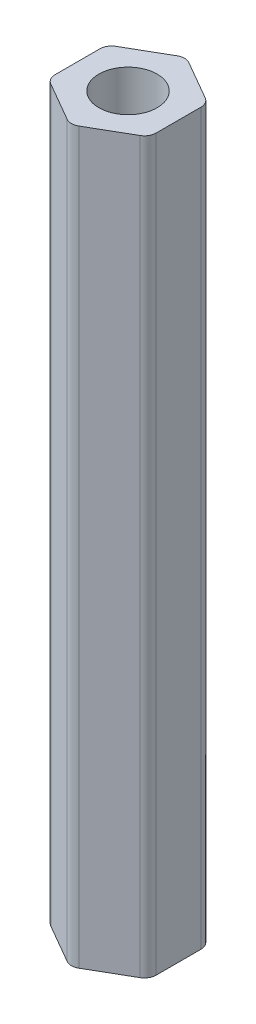
from build123d import *

# Parameters (mm, degrees)
SKETCH1_R           = 5
BOSS_EXTRUDE1_DEPTH = 125
FILLET1_R           = 2


with BuildPart() as part:
    # Sketch1 → Boss-Extrude1 (new body)
    with BuildSketch(Plane(origin=(0, 0, 0), x_dir=(1, 0, 0), z_dir=(0, 1, 0))):
        Polygon((8.660254038, -5), (8.660254038, 5), (0, 10), (-8.660254038, 5), (-8.660254038, -5), (0, -10), align=None)
        with Locations(Location((0, 0, 0), (0, 0, 270))):
            Circle(SKETCH1_R, mode=Mode.SUBTRACT)
    extrude(amount=BOSS_EXTRUDE1_DEPTH)

    # Fillet1
    fillet1_edges = [part.edges().sort_by_distance(p)[0] for p in [
        (0, 62.5, 10),
        (-8.660254038, 62.5, 5),
        (-8.660254038, 62.5, -5),
        (0, 62.5, -10),
        (8.660254038, 62.5, -5),
        (8.660254038, 62.5, 5),
    ]]
    fillet(fillet1_edges, radius=FILLET1_R)


solid = part.part
